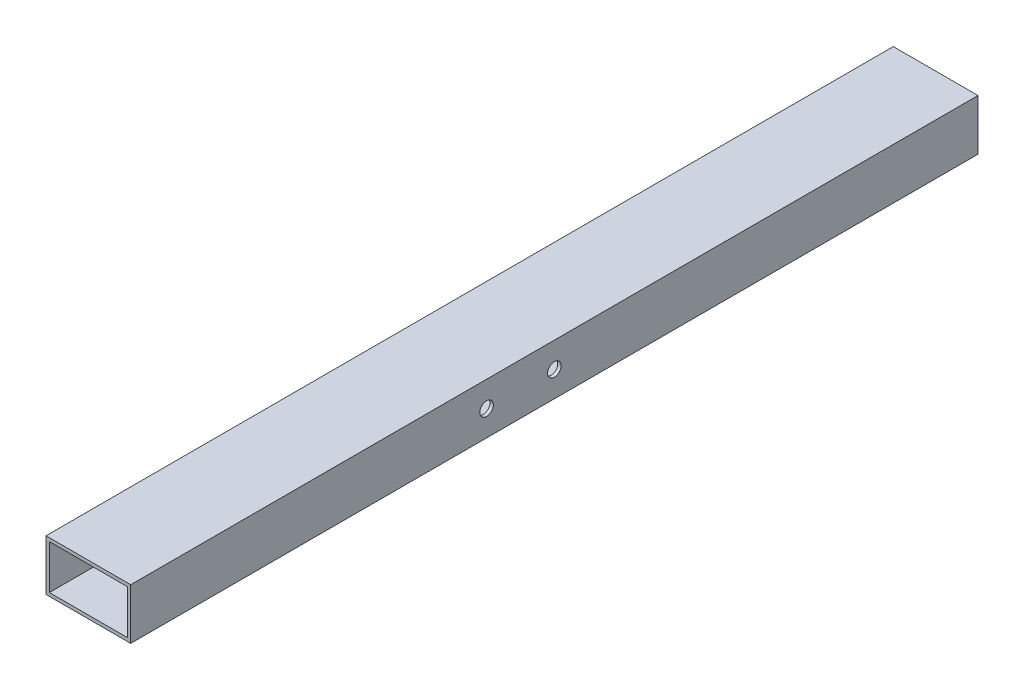
from build123d import *

# Parameters (mm, degrees)
SKETCH1_W           = 50
SKETCH1_H           = 30
SKETCH1_W_2         = 46
SKETCH1_H_2         = 26
BOSS_EXTRUDE1_DEPTH = 500
SKETCH2_R           = 4
CUT_EXTRUDE1_DEPTH  = 504.388517946


with BuildPart() as part:
    # Sketch1 → Boss-Extrude1 (new body)
    with BuildSketch(Plane.XY):
        with Locations((25, -15)):
            Rectangle(SKETCH1_W, SKETCH1_H)
        with Locations((25, -15)):
            Rectangle(SKETCH1_W_2, SKETCH1_H_2, mode=Mode.SUBTRACT)
    extrude(amount=BOSS_EXTRUDE1_DEPTH)

    # Sketch2 → Cut-Extrude1 (cut, through all)
    with BuildSketch(Plane(origin=(50, 0, 0), x_dir=(0, 0, -1), z_dir=(1, 0, 0))):
        with Locations(Location((-250, -15, 0), (0, 0, 90))):
            Circle(SKETCH2_R)
        with Locations(Location((-290, -15, 0), (0, 0, 90))):
            Circle(SKETCH2_R)
    extrude(amount=-CUT_EXTRUDE1_DEPTH, mode=Mode.SUBTRACT)


solid = part.part
